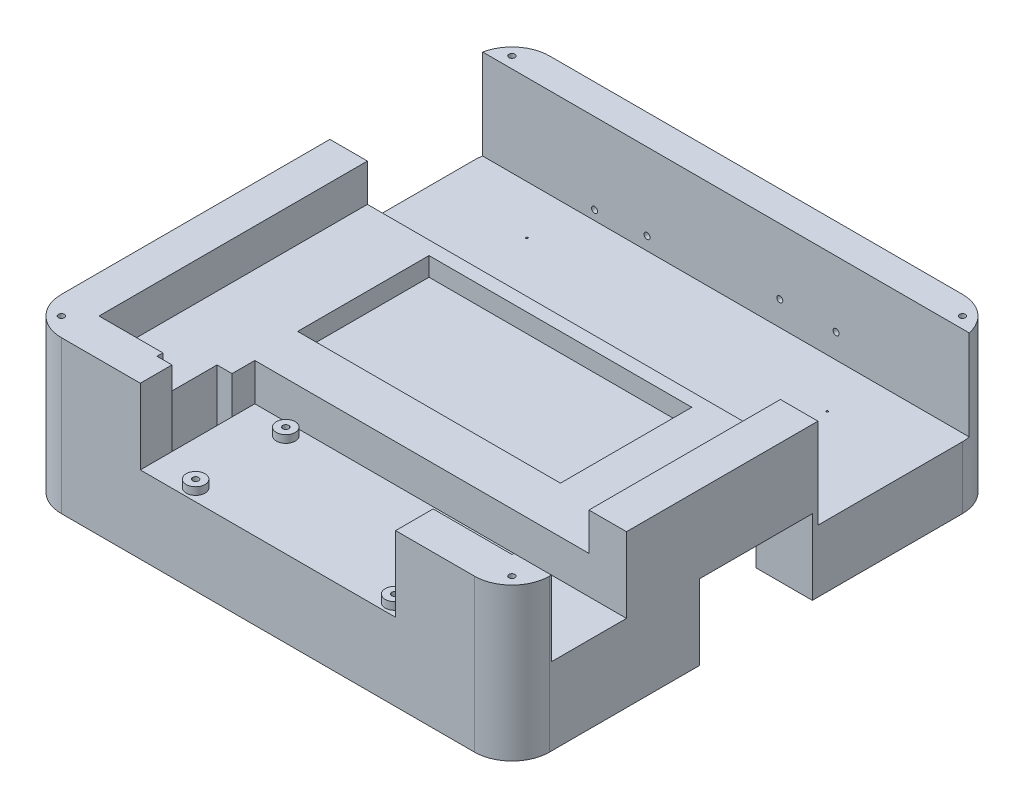
from build123d import *

# Parameters (mm, degrees)
SKETCH_1_W             = 130
SKETCH_1_H             = 130
EXTRUDE_1_DEPTH        = 40.6
SKETCH_2_W             = 130
SKETCH_2_H             = 40.5
CUT_EXTRUDE_1_DEPTH    = 24
SKETCH_7_W             = 16
SKETCH_7_H             = 30
CUT_EXTRUDE_5_DEPTH    = 20
CUT_EXTRUDE_8_DEPTH    = 10
HOLE_WIZARD_M2_1_D     = 1.6
HOLE_WIZARD_M2_1_DEPTH = 8
HOLE_WIZARD_M2_1_TIP   = 0.480688495
SKETCH_15_W            = 100
SKETCH_15_H            = 100
CUT_EXTRUDE_9_DEPTH    = 5
FILLET_1_R             = 10
HOLE_WIZARD_M2_3_D     = 1.6
HOLE_WIZARD_M2_3_DEPTH = 8
HOLE_WIZARD_M2_3_TIP   = 0.480688495
SKETCH_24_W            = 68
SKETCH_24_H            = 30.5
CUT_EXTRUDE_10_DEPTH   = 20
SKETCH_25_W            = 4
SKETCH_25_H            = 16
CUT_EXTRUDE_11_DEPTH   = 25
SKETCH_26_W            = 31
SKETCH_26_H            = 20
CUT_EXTRUDE_12_DEPTH   = 20
SKETCH_27_R            = 2.5
EXTRUDE_2_DEPTH        = 2
SKETCH_28_W            = 70
SKETCH_28_H            = 35
CUT_EXTRUDE_13_DEPTH   = 15
SKETCH_29_W            = 110
SKETCH_29_H            = 110
CUT_EXTRUDE_14_DEPTH   = 10
SKETCH_30_R            = 2.5
EXTRUDE_4_DEPTH        = 2
HOLE_WIZARD_M2_4_D     = 1.6
HOLE_WIZARD_M2_4_DEPTH = 8
HOLE_WIZARD_M2_4_TIP   = 0.480688495
HOLE_WIZARD_M3_1_D     = 2.5
HOLE_WIZARD_M3_1_DEPTH = 8
HOLE_WIZARD_M3_1_TIP   = 0.751075774
HOLE_WIZARD_M2_7_D     = 1.6
HOLE_WIZARD_M2_7_DEPTH = 8
HOLE_WIZARD_M2_7_TIP   = 0.480688495


with BuildPart() as part:
    # 草图1 → 凸台-拉伸1 (new body)
    with BuildSketch(Plane(origin=(0, 0, 0), x_dir=(1, 0, 0), z_dir=(0, 1, 0))):
        Rectangle(SKETCH_1_W, SKETCH_1_H)
    extrude(amount=EXTRUDE_1_DEPTH)

    # 草图2 → 切除-拉伸1 (cut)
    with BuildSketch(Plane(origin=(0, 40.6, 0), x_dir=(1, 0, 0), z_dir=(0, 1, 0))):
        with Locations((0, 36.75)):
            Rectangle(SKETCH_2_W, SKETCH_2_H)
    extrude(amount=-CUT_EXTRUDE_1_DEPTH, mode=Mode.SUBTRACT)

    # 草图7 → 切除-拉伸5 (cut)
    with BuildSketch(Plane.XZ):
        with Locations((57, 0)):
            Rectangle(SKETCH_7_W, SKETCH_7_H)
        with Locations((-57, 0)):
            Rectangle(SKETCH_7_W, SKETCH_7_H)
    extrude(amount=-CUT_EXTRUDE_5_DEPTH, mode=Mode.SUBTRACT)

    # 草图10 → 切除-拉伸8 (cut)
    with BuildSketch(Plane.XZ):
        with BuildLine():
            Line((-41, -50), (41, -50))
            ThreePointArc((41, -50), (44.535533906, -48.535533906), (46, -45))
            Line((46, -45), (46, 19))
            ThreePointArc((46, 19), (44.535533906, 22.535533906), (41, 24))
            Line((41, 24), (-41, 24))
            ThreePointArc((-41, 24), (-44.535533906, 22.535533906), (-46, 19))
            Line((-46, 19), (-46, -45))
            ThreePointArc((-46, -45), (-44.535533906, -48.535533906), (-41, -50))
        make_face()
    extrude(amount=-CUT_EXTRUDE_8_DEPTH, mode=Mode.SUBTRACT)

    # M2 螺纹孔的螺纹孔钻头1
    with Locations(Plane(origin=(0, 0, 0), x_dir=(-1, 0, 0), z_dir=(0, -1, 0))):
        with Locations((60, -60), (-60, -60), (60, 60), (-60, 60)):
            Hole(HOLE_WIZARD_M2_1_D / 2, depth=HOLE_WIZARD_M2_1_DEPTH)
            with Locations((0, 0, -(HOLE_WIZARD_M2_1_DEPTH + HOLE_WIZARD_M2_1_TIP / 2))):  # 118° drill point
                Cone(0, HOLE_WIZARD_M2_1_D / 2, HOLE_WIZARD_M2_1_TIP, mode=Mode.SUBTRACT)

    # 草图15 → 切除-拉伸9 (cut)
    with BuildSketch(Plane.XZ):
        Rectangle(SKETCH_15_W, SKETCH_15_H)
    extrude(amount=-CUT_EXTRUDE_9_DEPTH, mode=Mode.SUBTRACT)

    # 圆角1
    fillet_1_edges = [part.edges().sort_by_distance(p)[0] for p in [
        (65, 20.3, 65),
        (-65, 20.3, 65),
        (-65, 20.3, -65),
        (65, 20.3, -65),
    ]]
    fillet(fillet_1_edges, radius=FILLET_1_R)

    # M2 螺纹孔的螺纹孔钻头3
    with Locations(Plane(origin=(0, 40.6, 0), x_dir=(1, 0, 0), z_dir=(0, 1, 0))):
        with Locations((-60, 60), (60, 60), (60, -60), (-60, -60)):
            Hole(HOLE_WIZARD_M2_3_D / 2, depth=HOLE_WIZARD_M2_3_DEPTH)
            with Locations((0, 0, -(HOLE_WIZARD_M2_3_DEPTH + HOLE_WIZARD_M2_3_TIP / 2))):  # 118° drill point
                Cone(0, HOLE_WIZARD_M2_3_D / 2, HOLE_WIZARD_M2_3_TIP, mode=Mode.SUBTRACT)

    # 草图24 → 切除-拉伸10 (cut)
    with BuildSketch(Plane(origin=(0, 40.6, 0), x_dir=(1, 0, 0), z_dir=(0, 1, 0))):
        with Locations((0, -49.75)):
            Rectangle(SKETCH_24_W, SKETCH_24_H)
    extrude(amount=-CUT_EXTRUDE_10_DEPTH, mode=Mode.SUBTRACT)

    # 草图25 → 切除-拉伸11 (cut)
    with BuildSketch(Plane(origin=(0, 40.6, 0), x_dir=(1, 0, 0), z_dir=(0, 1, 0))):
        with Locations((-36, -48.559593505)):
            Rectangle(SKETCH_25_W, SKETCH_25_H)
    extrude(amount=-CUT_EXTRUDE_11_DEPTH, mode=Mode.SUBTRACT)

    # 草图26 → 切除-拉伸12 (cut)
    with BuildSketch(Plane(origin=(0, 40.6, 0), x_dir=(1, 0, 0), z_dir=(0, 1, 0))):
        with Locations((49.5, -44.5)):
            Rectangle(SKETCH_26_W, SKETCH_26_H)
    extrude(amount=-CUT_EXTRUDE_12_DEPTH, mode=Mode.SUBTRACT)

    # 草图27 → 凸台-拉伸2 (add)
    with BuildSketch(Plane(origin=(0, 20.6, 0), x_dir=(1, 0, 0), z_dir=(0, 1, 0))):
        with Locations(Location((30.5, -61.75, 0), (0, 0, 270))):
            Circle(SKETCH_27_R)
        with Locations(Location((-22.51, -61.75, 0), (0, 0, 270))):
            Circle(SKETCH_27_R)
        with Locations(Location((-22.51, -37.74, 0), (0, 0, 270))):
            Circle(SKETCH_27_R)
    extrude(amount=EXTRUDE_2_DEPTH)

    # 草图28 → 切除-拉伸13 (cut)
    with BuildSketch(Plane(origin=(0, 40.6, 0), x_dir=(1, 0, 0), z_dir=(0, 1, 0))):
        with Locations((0.006580057, -4.600945461)):
            Rectangle(SKETCH_28_W, SKETCH_28_H)
    extrude(amount=-CUT_EXTRUDE_13_DEPTH, mode=Mode.SUBTRACT)

    # 草图29 → 切除-拉伸14 (cut)
    with BuildSketch(Plane(origin=(0, 40.6, 0), x_dir=(1, 0, 0), z_dir=(0, 1, 0))):
        Rectangle(SKETCH_29_W, SKETCH_29_H)
    extrude(amount=-CUT_EXTRUDE_14_DEPTH, mode=Mode.SUBTRACT)

    # 草图30 → 凸台-拉伸4 (add)
    with BuildSketch(Plane.XZ.offset(-10)):
        with Locations(Location((40, 18, 0), (0, 0, 90))):
            Circle(SKETCH_30_R)
        with Locations(Location((40, -44, 0), (0, 0, 90))):
            Circle(SKETCH_30_R)
        with Locations(Location((-40, -44, 0), (0, 0, 90))):
            Circle(SKETCH_30_R)
        with Locations(Location((-40, 18, 0), (0, 0, 90))):
            Circle(SKETCH_30_R)
    extrude(amount=EXTRUDE_4_DEPTH)

    # M2 螺纹孔的螺纹孔钻头4
    with Locations(Plane(origin=(0, 0, -65), x_dir=(-1, 0, 0), z_dir=(0, 0, -1))):
        with Locations((-29.333554251, 23.053823954), (-14.333768955, 23.134080314), (21.033223503, 20.063926498), (35, 19.1)):
            Hole(HOLE_WIZARD_M2_4_D / 2, depth=HOLE_WIZARD_M2_4_DEPTH)
            with Locations((0, 0, -(HOLE_WIZARD_M2_4_DEPTH + HOLE_WIZARD_M2_4_TIP / 2))):  # 118° drill point
                Cone(0, HOLE_WIZARD_M2_4_D / 2, HOLE_WIZARD_M2_4_TIP, mode=Mode.SUBTRACT)

    # M3 螺纹孔的螺纹孔钻头1
    with Locations(Plane(origin=(0, 8, 0), x_dir=(-1, 0, 0), z_dir=(0, -1, 0))):
        with Locations((40, -18), (-40, -18), (40, 44), (-40, 44)):
            Hole(HOLE_WIZARD_M3_1_D / 2, depth=HOLE_WIZARD_M3_1_DEPTH)
            with Locations((0, 0, -(HOLE_WIZARD_M3_1_DEPTH + HOLE_WIZARD_M3_1_TIP / 2))):  # 118° drill point
                Cone(0, HOLE_WIZARD_M3_1_D / 2, HOLE_WIZARD_M3_1_TIP, mode=Mode.SUBTRACT)

    # M2 螺纹孔的螺纹孔钻头7
    with Locations(Plane(origin=(0, 22.6, 0), x_dir=(1, 0, 0), z_dir=(0, 1, 0))):
        with Locations((-22.51, -37.74), (-22.51, -61.75), (30.5, -61.75)):
            Hole(HOLE_WIZARD_M2_7_D / 2, depth=HOLE_WIZARD_M2_7_DEPTH)
            with Locations((0, 0, -(HOLE_WIZARD_M2_7_DEPTH + HOLE_WIZARD_M2_7_TIP / 2))):  # 118° drill point
                Cone(0, HOLE_WIZARD_M2_7_D / 2, HOLE_WIZARD_M2_7_TIP, mode=Mode.SUBTRACT)


solid = part.part
